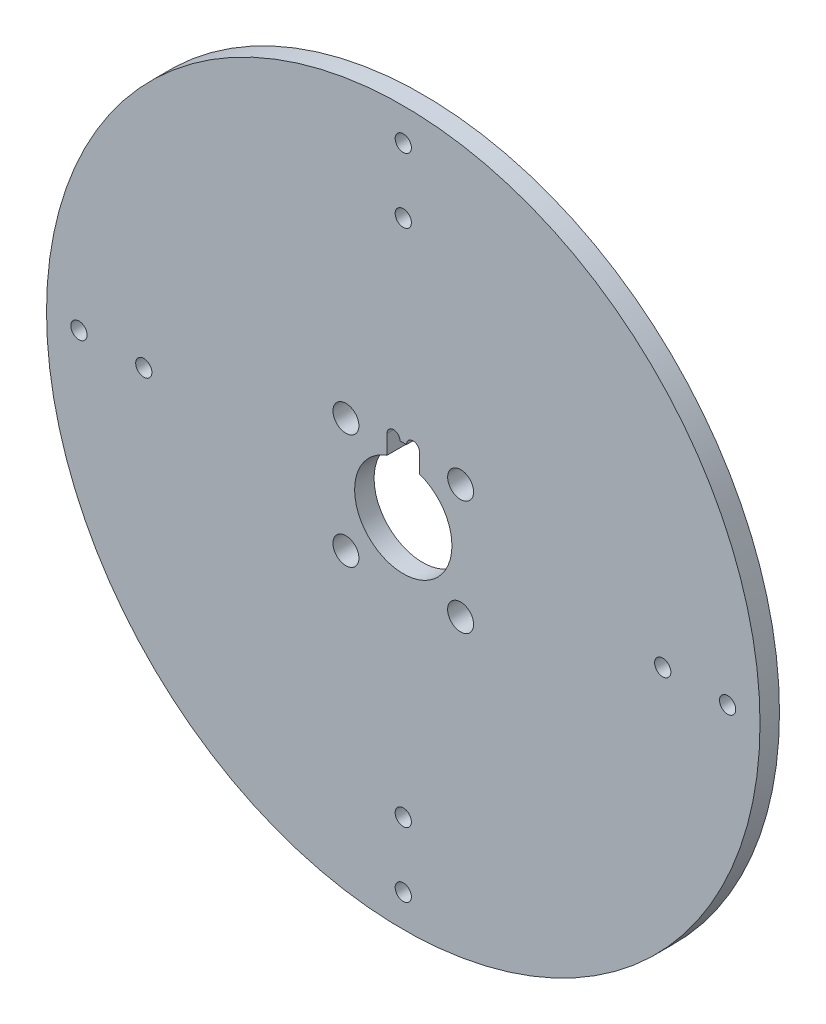
from build123d import *

# Parameters (mm, degrees)
SKETCH_1_R               = 55
EXTRUDE_1_DEPTH          = 1.5
CUT_EXTRUDE_7_DEPTH      = 78.796208134
CUT_EXTRUDE_7_DEPTH_BACK = 78.796208134
M3X0_5_1_D               = 2.5
F_4_0MM_1_D              = 4
F_4_0MM_1_DEPTH          = 5
F_4_0MM_1_TIP            = 1.201721238


with BuildPart() as part:
    # ｽｹｯﾁ1 → ﾎﾞｽ - 押し出し1 (new, symmetric)
    with BuildSketch(Plane.XY):
        Circle(SKETCH_1_R)
    extrude(amount=EXTRUDE_1_DEPTH, both=True)

    # ｽｹｯﾁ1<4> → ｶｯﾄ - 押し出し7 (cut, two sides: drawn at the far end of the back side and taken through both)
    with BuildSketch(Plane.XY.offset(-CUT_EXTRUDE_7_DEPTH_BACK)):
        with BuildLine():
            Line((-2.5, 10), (-2.5, 7.071067812))
            ThreePointArc((-2.5, 7.071067812), (0, -7.5), (2.5, 7.071067812))
            Line((2.5, 7.071067812), (2.5, 10))
            ThreePointArc((2.5, 10), (1.5, 11), (0.5, 10))
            Line((0.5, 10), (-0.5, 10))
            ThreePointArc((-0.5, 10), (-1.5, 11), (-2.5, 10))
        make_face()
    extrude(amount=CUT_EXTRUDE_7_DEPTH + CUT_EXTRUDE_7_DEPTH_BACK, mode=Mode.SUBTRACT)

    # M3x0.5 ねじ穴1 (through all)
    with Locations(Plane(origin=(0, 50, 1.5), x_dir=(1, 0, 0), z_dir=(0, 0, 1))):
        with Locations((0, 0), (0, -10), (-50, -50), (-40, -50), (0, -100), (0, -90), (50, -50), (40, -50)):
            Hole(M3X0_5_1_D / 2)

    # Ø4.0mm ﾀﾞｳｴﾙ穴1
    with Locations(Plane.XY.offset(1.5)):
        with Locations((-8.838834765, -8.838834765), (-8.838834765, 8.838834765), (8.838834765, 8.838834765), (8.838834765, -8.838834765)):
            Hole(F_4_0MM_1_D / 2, depth=F_4_0MM_1_DEPTH)
            with Locations((0, 0, -(F_4_0MM_1_DEPTH + F_4_0MM_1_TIP / 2))):  # 118° drill point
                Cone(0, F_4_0MM_1_D / 2, F_4_0MM_1_TIP, mode=Mode.SUBTRACT)


solid = part.part
